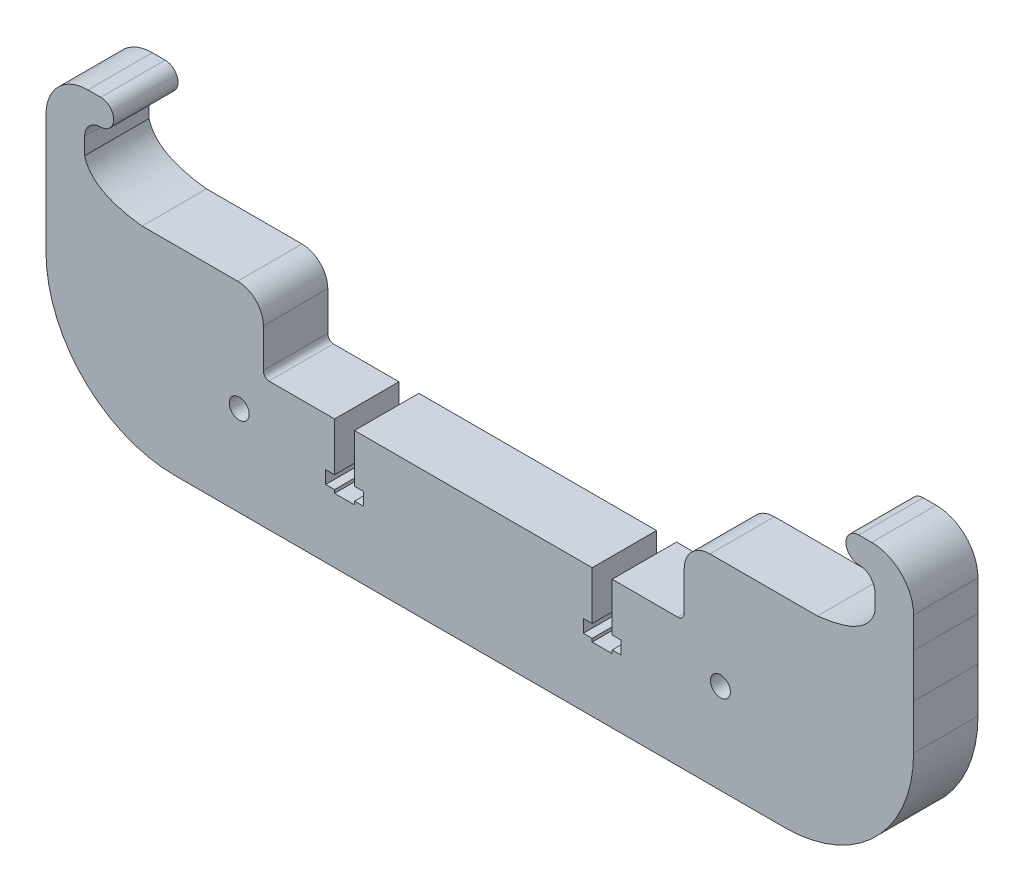
from build123d import *

# Parameters (mm, degrees)
DODANIE_WYCI_GNI_CIE1_DEPTH = 10
SZKIC2_R                    = 1.55
WYTNIJ_WYCI_GNI_CIE1_DEPTH  = 10
WYTNIJ_WYCI_GNI_CIE2_DEPTH  = 10
DODANIE_WYCI_GNI_CIE2_DEPTH = 10


with BuildPart() as part:
    # Szkic1 → Dodanie-wyciągnięcie1 (new body)
    with BuildSketch(Plane.XY):
        with BuildLine():
            Line((587.414080321, -426.296177349), (650.882642176, -426.296177349))
            ThreePointArc((650.882642176, -426.296177349), (651.591558731, -426.002534497), (651.885201582, -425.293617942))
            Line((651.885201582, -425.293617942), (651.885201582, -419.296173179))
            ThreePointArc((651.885201582, -419.296173179), (653.056774457, -416.467746055), (655.885201582, -415.296173179))
            Line((655.885201582, -415.296173179), (672.570535687, -415.296173179))
            add(Edge.make_bspline(
                [(672.570535687, -415.296173179), (680.339252511, -414.463378733), (681.492424358, -410.309612352)],
                knots=[0, 0, 0, 1, 1, 1], degree=2))
            Line((681.492424358, -410.309612352), (681.492424358, -407.696232794))
            ThreePointArc((681.492424358, -407.696232794), (680.760191311, -405.928465841), (678.992424358, -405.196232794))
            ThreePointArc((678.992424358, -405.196232794), (676.992424358, -403.196232794), (678.992424358, -401.196232794))
            Line((678.992424358, -401.196232794), (680.992424358, -401.196232794))
            ThreePointArc((680.992424358, -401.196232794), (685.588618435, -403.100038717), (687.492424358, -407.696232794))
            Line((687.492424358, -407.696232794), (687.492424358, -412.4992576))
            Line((687.492424358, -412.4992576), (687.497764867, -419.296173358))
            ThreePointArc((687.497764867, -419.296173358), (681.63990049, -433.438308981), (667.497764867, -439.296173358))
            Line((667.497764867, -439.296173358), (572.803105375, -439.296173358))
            ThreePointArc((572.803105375, -439.296173358), (558.660969752, -433.438308981), (552.803105375, -419.296173358))
            Line((552.803105375, -419.296173358), (552.803105375, -407.696232794))
            ThreePointArc((552.803105375, -407.696232794), (554.706911183, -403.100038993), (559.303104985, -401.196233185))
            Line((559.303104985, -401.196233185), (561.303104985, -401.196232404))
            ThreePointArc((561.303104985, -401.196232404), (563.303105554, -403.196232208), (561.303105749, -405.196232777))
            ThreePointArc((561.303105749, -405.196232777), (559.535338555, -405.928465692), (558.803105376, -407.696232777))
            Line((558.803105376, -407.696232777), (558.803105375, -410.309612352))
            add(Edge.make_bspline(
                [(567.724994046, -415.296173179), (559.956277223, -414.463378733), (558.803105375, -410.309612352)],
                knots=[0, 0, 0, 1, 1, 1], degree=2))
            Line((567.724994046, -415.296173179), (582.555068068, -415.296173179))
            ThreePointArc((582.555068068, -415.296173179), (585.383495193, -416.467746055), (586.555068068, -419.296173179))
            Line((586.555068068, -419.296173179), (586.555068068, -425.296173358))
            ThreePointArc((586.555068068, -425.296173358), (586.777466587, -425.974082616), (587.414080321, -426.296177349))
        make_face()
    extrude(amount=DODANIE_WYCI_GNI_CIE1_DEPTH)

    # Szkic2 → Wytnij-wyciągnięcie1 (cut)
    with BuildSketch(Plane.XY.offset(10)):
        with Locations((657.507953751, -432.275447831)):
            Circle(SZKIC2_R)
        with Locations((582.803105375, -432.296173587)):
            Circle(SZKIC2_R)
    extrude(amount=-WYTNIJ_WYCI_GNI_CIE1_DEPTH, mode=Mode.SUBTRACT)

    # Szkic3 → Wytnij-wyciągnięcie2 (cut)
    with BuildSketch(Plane(origin=(0, 0, 0), x_dir=(-1, 0, 0), z_dir=(0, 0, -1))):
        Polygon((-600.699082892, -426.296174265), (-600.699082892, -433.796174265), (-602.074082892, -433.796174265), (-602.074082892, -435.796174265), (-600.699082892, -435.796174265), (-600.699082892, -436.296174265), (-597.599082892, -436.296174265), (-597.599082892, -435.796174265), (-596.224082892, -435.796174265), (-596.224082892, -433.796174265), (-597.599082892, -433.796174265), (-597.599082892, -426.296174265), align=None)
        Polygon((-640.699082892, -426.296174265), (-640.699082892, -433.796174265), (-642.074082892, -433.796174265), (-642.074082892, -435.796174265), (-640.699082892, -435.796174265), (-640.699082892, -436.296174265), (-637.599082892, -436.296174265), (-637.599082892, -435.796174265), (-636.224082892, -435.796174265), (-636.224082892, -433.796174265), (-637.599082892, -433.796174265), (-637.599082892, -426.296174265), align=None)
    extrude(amount=-WYTNIJ_WYCI_GNI_CIE2_DEPTH, mode=Mode.SUBTRACT)

    # Szkic4 → Dodanie-wyciągnięcie2 (add)
    with BuildSketch(Plane(origin=(0, 0, 0), x_dir=(-1, 0, 0), z_dir=(0, 0, -1))):
        with BuildLine():
            Line((-572.80310596, -446.29617968), (-667.497765451, -446.296171767))
            ThreePointArc((-667.497765451, -446.296171767), (-681.639900798, -440.438306104), (-687.497764867, -426.296170096))
            Line((-687.497764867, -426.296170096), (-687.497764867, -419.296173358))
            ThreePointArc((-687.497764867, -419.296173358), (-681.63990049, -433.438308981), (-667.497764867, -439.296173358))
            Line((-667.497764867, -439.296173358), (-572.803105375, -439.296173358))
            ThreePointArc((-572.803105375, -439.296173358), (-558.660969752, -433.438308981), (-552.803105375, -419.296173358))
            Line((-552.803105375, -419.296173358), (-552.803105375, -426.296181351))
            ThreePointArc((-552.803105375, -426.296181351), (-558.660970549, -440.438316101), (-572.80310596, -446.29617968))
        make_face()
    extrude(amount=-DODANIE_WYCI_GNI_CIE2_DEPTH)


solid = part.part
